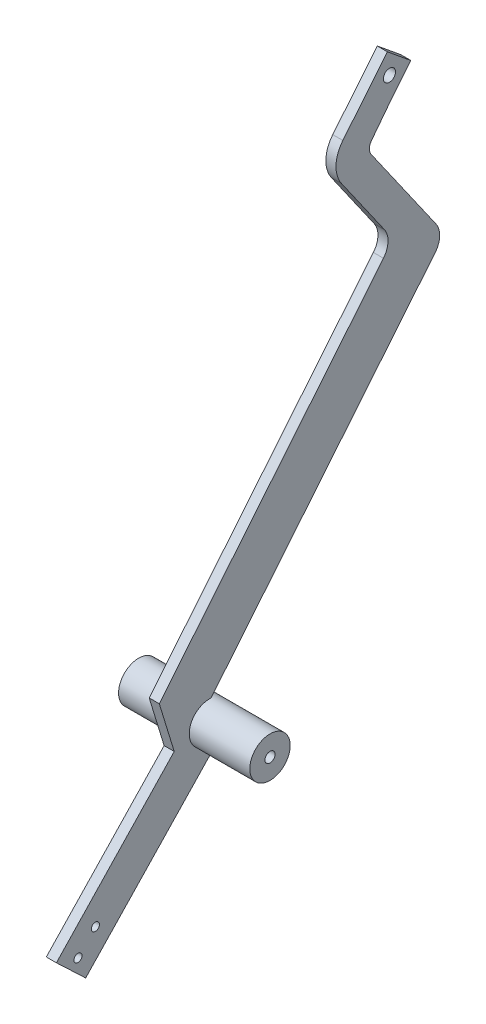
from build123d import *

# Parameters (mm, degrees)
SKETCH3_R           = 20
SKETCH3_R_2         = 5
BOSS_EXTRUDE1_DEPTH = 65
SKETCH5_R           = 4
BOSS_EXTRUDE2_DEPTH = 5
SKETCH6_R           = 6
BOSS_EXTRUDE3_DEPTH = 5


with BuildPart() as part:
    # Sketch3 → Boss-Extrude1 (new, symmetric)
    with BuildSketch(Plane(origin=(-60.998160412, 1573.060549462, 105.066831328), x_dir=(-7.089494789387439e-06, 0.7736078193168969, -0.6336646919637345), z_dir=(0.9999999999388507, 1.0625452875874706e-07, -1.1058365005240594e-05))):
        with Locations(Location((-394.045278836, 76.348788506, 0), (0, 0, 309.321017381))):
            Circle(SKETCH3_R)
        with Locations(Location((-394.045278836, 76.348788506, 0), (0, 0, 309.321017381))):
            Circle(SKETCH3_R_2, mode=Mode.SUBTRACT)
    extrude(amount=BOSS_EXTRUDE1_DEPTH, both=True)

    # Sketch5 → Boss-Extrude2 (add, symmetric)
    with BuildSketch(Plane(origin=(-60.998160412, 1573.060549462, 105.066831328), x_dir=(-7.089494789387439e-06, 0.7736078193168969, -0.6336646919637345), z_dir=(0.9999999999388507, 1.0625452875874706e-07, -1.1058365005240594e-05))):
        with BuildLine():
            Line((-392.58424152, 96.295351367), (-591.123204204, 110.837848496))
            Line((-591.123204204, 110.837848496), (-594.045278836, 70.944722775))
            Line((-594.045278836, 70.944722775), (-395.506316152, 56.402225645))
            ThreePointArc((-395.506316152, 56.402225645), (-413.991841697, 77.809825822), (-392.58424152, 96.295351367))
        make_face()
        with Locations(Location((-582.61096009, 90.160766978, 0), (0, 0, 309.321017381))):
            Circle(SKETCH5_R, mode=Mode.SUBTRACT)
        with Locations(Location((-557.677756514, 88.334470333, 0), (0, 0, 309.321017381))):
            Circle(SKETCH5_R, mode=Mode.SUBTRACT)
    extrude(amount=BOSS_EXTRUDE2_DEPTH, both=True)

    # Sketch6 → Boss-Extrude3 (add, symmetric)
    with BuildSketch(Plane(origin=(-60.998160412, 1573.060549462, 105.066831328), x_dir=(-7.089494789387439e-06, 0.7736078193168969, -0.6336646919637345), z_dir=(0.9999999999388507, 1.0625452875874706e-07, -1.1058365005240594e-05))):
        with BuildLine():
            Line((-377.619831435, 87.759514937), (-27.292927768, 87.759514937))
            ThreePointArc((-27.292927768, 87.759514937), (-15.216854672, 91.816853346), (-8.040453097, 102.342669078))
            Line((-8.040453097, 102.342669078), (22.302714772, 210.187914454))
            ThreePointArc((22.302714772, 210.187914454), (25.770680796, 215.358304534), (31.625575655, 217.474888601))
            Line((31.625575655, 217.474888601), (64.13601707, 218.461633032))
            Line((64.13601707, 218.461633032), (94.344670441, 218.461633032))
            Line((94.344670441, 218.461633032), (94.344670441, 248.461633032))
            Line((94.344670441, 248.461633032), (64.344670441, 248.461633032))
            Line((64.344670441, 248.461633032), (24.630595161, 248.461633032))
            ThreePointArc((24.630595161, 248.461633032), (6.516485518, 242.375625418), (-4.248116845, 226.586901821))
            Line((-4.248116845, 226.586901821), (-24.356369864, 155.118441762))
            ThreePointArc((-24.356369864, 155.118441762), (-31.532771439, 144.592626031), (-43.608844534, 140.535287621))
            Line((-43.608844534, 140.535287621), (-394.045278836, 140.535287621))
            Line((-394.045278836, 140.535287621), (-422.057084413, 98.454165573))
            Line((-422.057084413, 98.454165573), (-387.307739228, 95.179761928))
            ThreePointArc((-387.307739228, 95.179761928), (-381.884028565, 92.22657147), (-377.619831435, 87.759514937))
        make_face()
        with Locations(Location((79.292687871, 233.513615603, 0), (0, 0, 309.321017381))):
            Circle(SKETCH6_R, mode=Mode.SUBTRACT)
    extrude(amount=BOSS_EXTRUDE3_DEPTH, both=True)


solid = part.part
